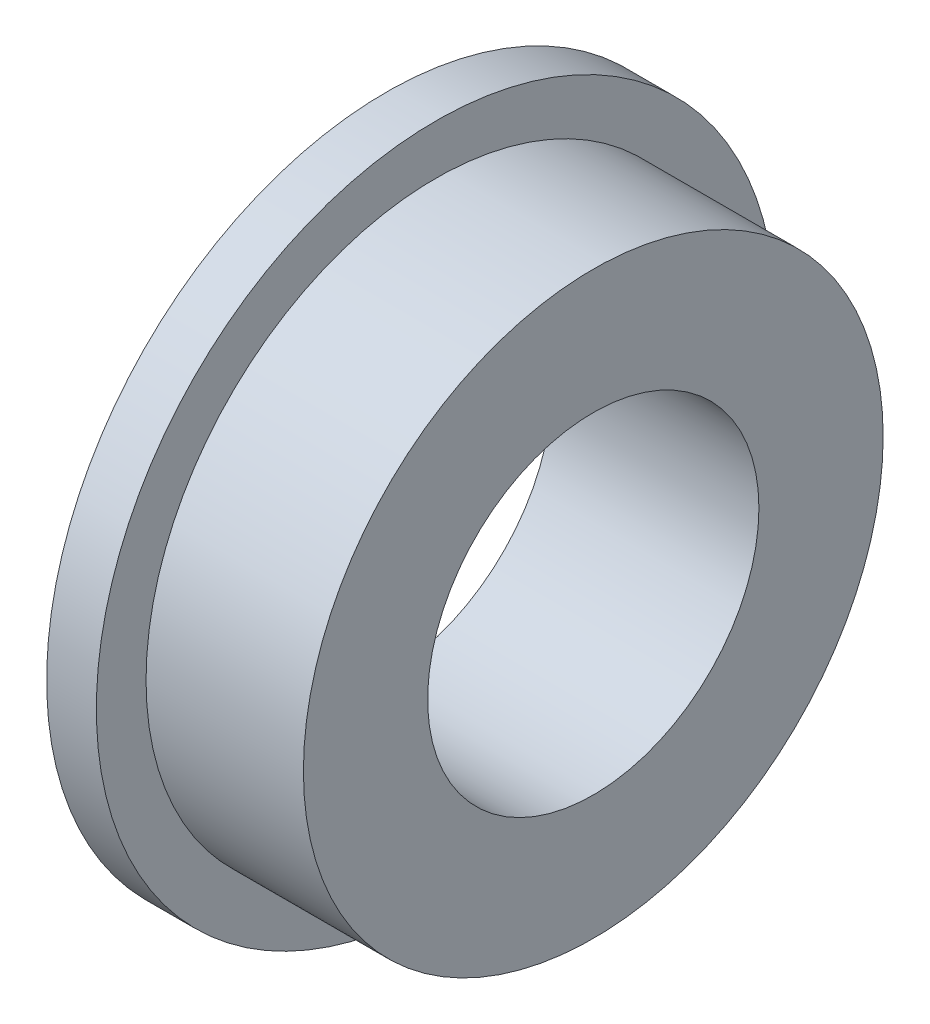
from build123d import *

# Parameters (mm, degrees)
SKETCH_1_R          = 4.1
SKETCH_1_R_2        = 2
EXTRUDE_1_DEPTH     = 2.5
SKETCH_2_OUTSIDE_W  = 12.572
SKETCH_2_OUTSIDE_H  = 12.572
SKETCH_2_OUTSIDE_R  = 3.5
CUT_EXTRUDE_1_DEPTH = 1.9


with BuildPart() as part:
    # 草图1 → 凸台-拉伸1 (new body)
    with BuildSketch(Plane(origin=(0, 0, 0), x_dir=(0, 0, -1), z_dir=(1, 0, 0))):
        Circle(SKETCH_1_R)
        Circle(SKETCH_1_R_2, mode=Mode.SUBTRACT)
    extrude(amount=EXTRUDE_1_DEPTH)

    # 草图2 outside → 切除-拉伸1 (cut)
    with BuildSketch(Plane(origin=(2.5, 0, 0), x_dir=(0, 0, -1), z_dir=(1, 0, 0))):
        Rectangle(SKETCH_2_OUTSIDE_W, SKETCH_2_OUTSIDE_H)
        Circle(SKETCH_2_OUTSIDE_R, mode=Mode.SUBTRACT)
    extrude(amount=-CUT_EXTRUDE_1_DEPTH, mode=Mode.SUBTRACT)


solid = part.part
